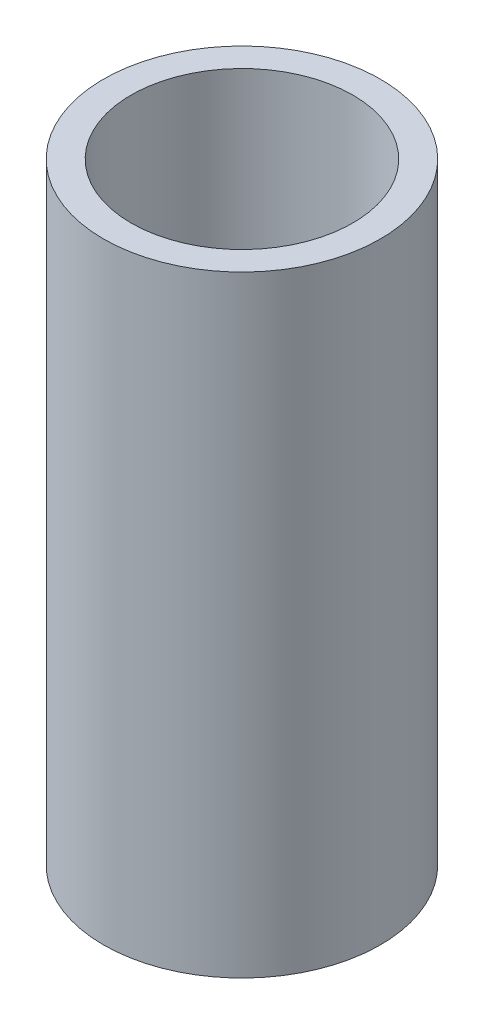
from build123d import *

# Parameters (mm, degrees)
SKETCH1_R           = 2.185
SKETCH1_R_2         = 1.75
BOSS_EXTRUDE1_DEPTH = 9.65


with BuildPart() as part:
    # Sketch1 → Boss-Extrude1 (new body)
    with BuildSketch(Plane(origin=(0, 0, 0), x_dir=(1, 0, 0), z_dir=(0, 1, 0))):
        with Locations(Location((0, 0, 0), (0, 0, 270))):
            Circle(SKETCH1_R)
        with Locations(Location((0, 0, 0), (0, 0, 270))):
            Circle(SKETCH1_R_2, mode=Mode.SUBTRACT)
    extrude(amount=BOSS_EXTRUDE1_DEPTH)


solid = part.part
